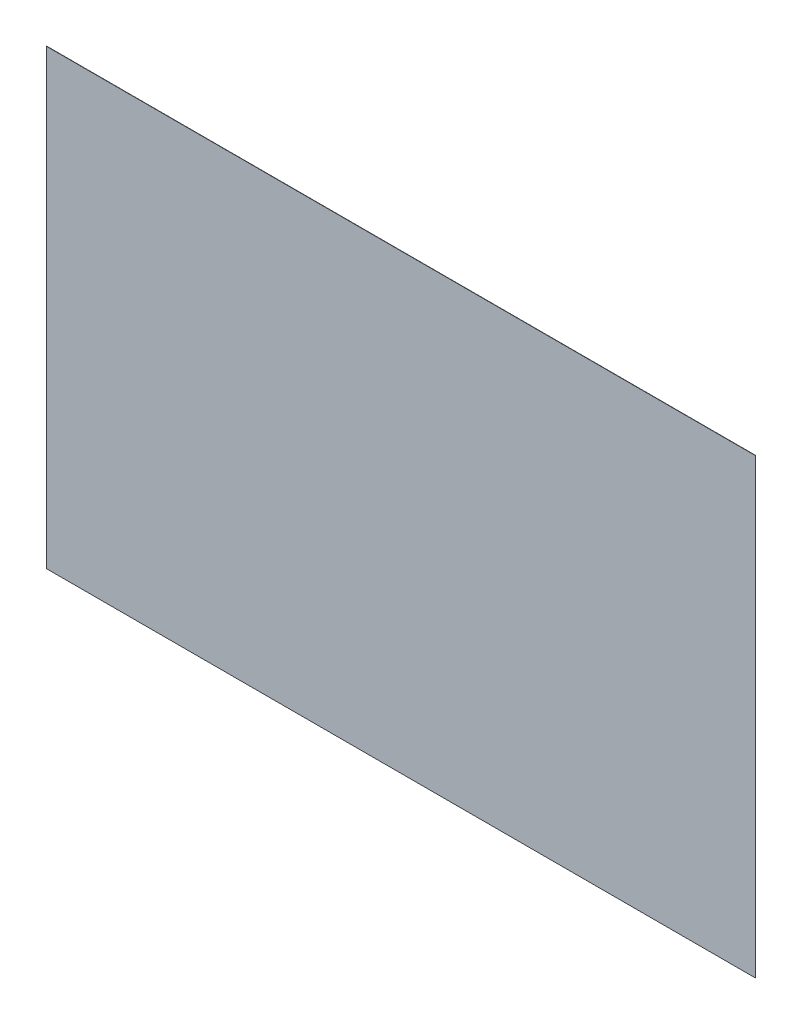
from build123d import *

# Parameters (mm, degrees)
SKETCH1_W           = 2500
SKETCH1_H           = 1595
BOSS_EXTRUDE1_DEPTH = 1


with BuildPart() as part:
    # Sketch1 → Boss-Extrude1 (new body)
    with BuildSketch(Plane.XY):
        with Locations((1250, 797.5)):
            Rectangle(SKETCH1_W, SKETCH1_H)
    extrude(amount=BOSS_EXTRUDE1_DEPTH)


solid = part.part
